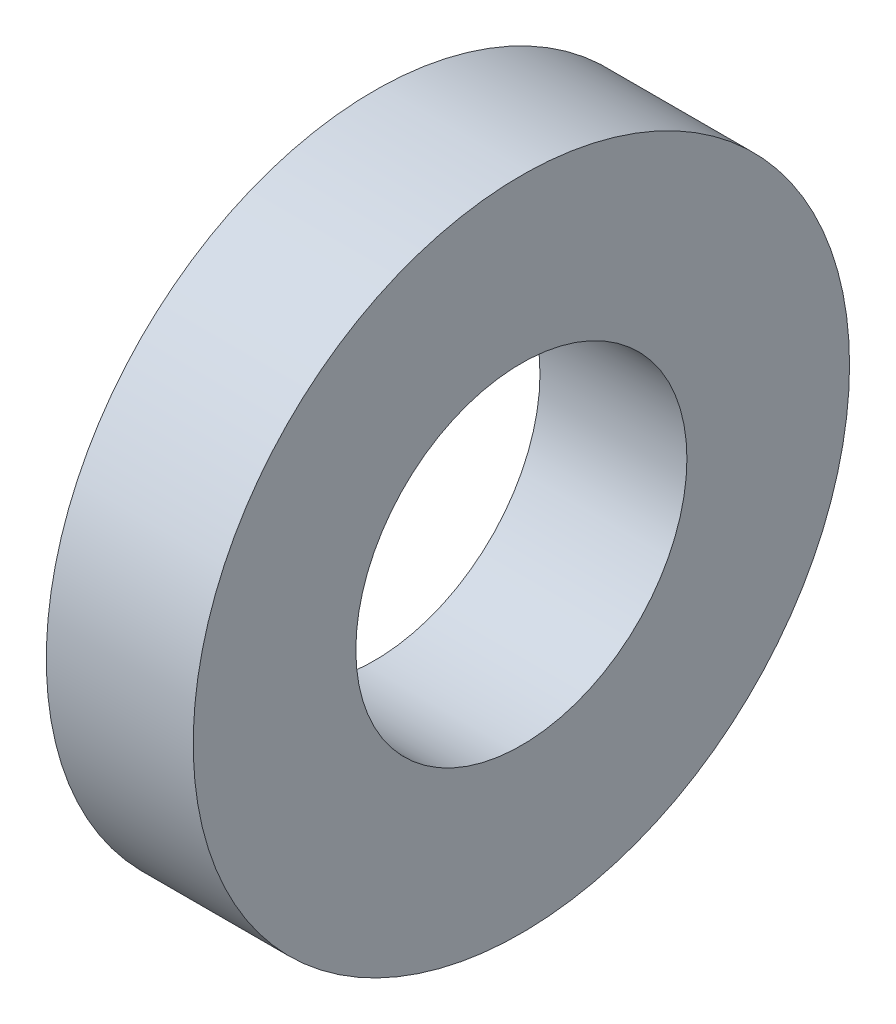
from build123d import *

# Parameters (mm, degrees)
SKETCH1_R           = 33.5
SKETCH1_R_2         = 16.9
BOSS_EXTRUDE1_DEPTH = 15


with BuildPart() as part:
    # Sketch1 → Boss-Extrude1 (new body)
    with BuildSketch(Plane(origin=(0, 0, 0), x_dir=(0, 0, -1), z_dir=(1, 0, 0))):
        Circle(SKETCH1_R)
        Circle(SKETCH1_R_2, mode=Mode.SUBTRACT)
    extrude(amount=BOSS_EXTRUDE1_DEPTH)


solid = part.part
